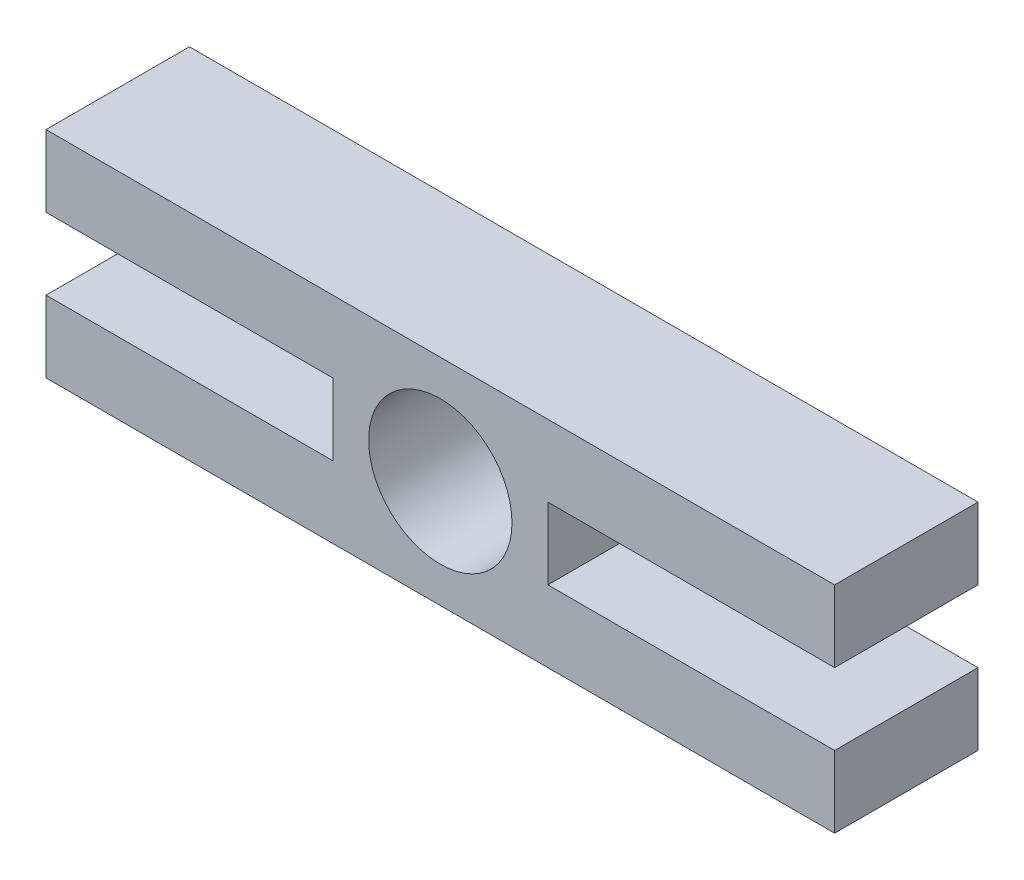
from build123d import *

# Parameters (mm, degrees)
SKETCH1_R           = 12.7
BOSS_EXTRUDE1_DEPTH = 25.4


with BuildPart() as part:
    # Sketch1 → Boss-Extrude1 (new body)
    with BuildSketch(Plane.XY):
        Polygon((-50.8, 0), (-50.8, 6.35), (0, 6.35), (0, 19.05), (-50.8, 19.05), (-50.8, 25.4), (-50.8, 31.75), (19.05, 31.75), (88.9, 31.75), (88.9, 25.4), (88.9, 19.05), (38.1, 19.05), (38.1, 6.35), (88.9, 6.35), (88.9, 0), (88.9, -6.35), (19.05, -6.35), (-50.8, -6.35), align=None)
        with Locations((19.05, 12.7)):
            Circle(SKETCH1_R, mode=Mode.SUBTRACT)
    extrude(amount=BOSS_EXTRUDE1_DEPTH)


solid = part.part
